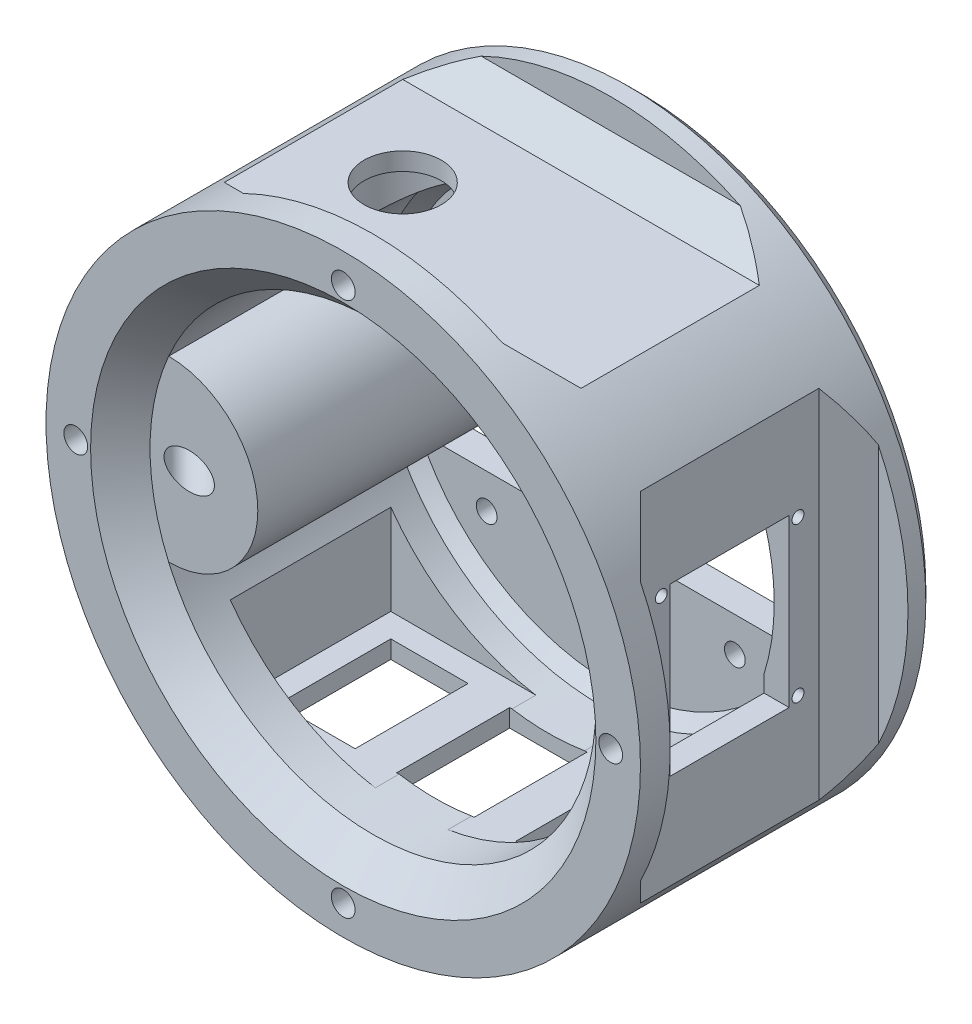
from build123d import *

# Parameters (mm, degrees)
ESQUISSE1_R                   = 50
BOSS_EXTRU_1_DEPTH            = 50
ENL_V_MAT_EXTRU_1_DEPTH       = 9.999999999999984
R_P_TITION_CIRCULAIRE1_COUNT  = 4
CHANFREIN1_SIZE               = 5
ESQUISSE11_R                  = 13.500000000000002
BOSS_EXTRU_3_DEPTH            = 4.999999999999999
ESQUISSE4_R                   = 37.50000000000001
ENL_V_MAT_EXTRU_2_DEPTH       = 50
CHANFREIN2_SIZE               = 5
BOSS_EXTRU_2_DEPTH            = 4.9999999999999964
ESQUISSE5_R                   = 1.7500000000000004
ENL_V_MAT_EXTRU_3_DEPTH       = 5
ESQUISSE7_R                   = 2.000000000000003
ENL_V_MAT_EXTRU_4_DEPTH       = 5.999999999999993
R_P_TITION_CIRCULAIRE2_COUNT  = 4
CHANFREIN3_SIZE               = 2
ESQUISSE8_W                   = 13
ESQUISSE8_H                   = 19.000000000000004
ESQUISSE8_W_2                 = 12.999999999999996
ESQUISSE8_H_2                 = 18.999999999999993
ENL_V_MAT_EXTRU_5_DEPTH       = 18.999999999999986
ENL_V_MAT_EXTRU_6_REACH       = 106.174
ENL_V_MAT_EXTRU_8_DEPTH       = 19.000000000000004
BOSS_EXTRU_4_DEPTH            = 45.000000000000014
ENL_V_START                   = 17
ESQUISSE12_R                  = 13.500000000000002
ENL_V_MAT_EXTRU_10_DEPTH      = 17
ESQUISSE15_R                  = 3.0000000000000013
ENL_V_MAT_EXTRU_11_DEPTH      = 17
ESQUISSE16_R                  = 11.99999999999999
ENL_V_MAT_EXTRU_12_DEPTH      = 0.9999999999999931
CHANFREIN4_SIZE               = 7
CHANFREIN5_SIZE               = 2
ENL_V_MAT_EXTRU_13_DEPTH      = 5.999999999999993
ENL_V_MAT_EXTRU_14_DEPTH      = 0.9999999999999931
ENL_V_MAT_EXTRU_14_DEPTH_BACK = 5.999999999999993
ESQUISSE19_R                  = 0.9999999999999983
ENL_V_MAT_EXTRU_15_DEPTH      = 5.999999999999993
ESQUISSE20_R                  = 6.499999999999999
ENL_V_MAT_EXTRU_16_DEPTH      = 13
ENL_V_MAT_EXTRU_17_DEPTH      = 7.9999999999999964
ENL_V_MAT_EXTRU_17_DEPTH_BACK = 7.9999999999999964
ESQUISSE21_R                  = 11.500000000000004


with BuildPart() as part:
    # Esquisse1 → Boss.-Extru.1 (new body)
    with BuildSketch(Plane.XY):
        Circle(ESQUISSE1_R)
    extrude(amount=BOSS_EXTRU_1_DEPTH)

    # Esquisse3 → Enlèv. mat.-Extru.1 (cut)
    with BuildSketch(Plane(origin=(0, 50, 0), x_dir=(1, 0, 0), z_dir=(0, 1, 0))):
        Polygon((0, -45), (0, -4.9999999999999964), (-45.00000000000001, -5.000000000000003), (-45.00000000000001, -45.00000000000001), align=None)
        Polygon((44.99999999999999, -4.99999999999999), (0, -4.9999999999999964), (0, -45), (45, -44.99999999999999), align=None)
    enl_v_mat_extru_1 = extrude(amount=-ENL_V_MAT_EXTRU_1_DEPTH, mode=Mode.SUBTRACT)

    # Répétition circulaire1: Enlèv. mat.-Extru.1 ×4 about axis
    r_p_tition_circulaire1_axis = Axis((0, 0, 0), (0, 0, 1))
    for i in range(1, R_P_TITION_CIRCULAIRE1_COUNT):
        add(enl_v_mat_extru_1.rotate(r_p_tition_circulaire1_axis, i * 360 / R_P_TITION_CIRCULAIRE1_COUNT), mode=Mode.SUBTRACT)

    # Chanfrein1
    chanfrein1_edges = [part.edges().sort_by_distance(p)[0] for p in [
        (0, 40.000000000000014, 45),
        (40.000000000000014, -8.88e-15, 45),
        (40.000000000000014, -8.88e-15, 4.9999999999999964),
        (-4.9e-15, -40.000000000000014, 4.9999999999999964),
        (-40.000000000000014, 4.44e-15, 4.9999999999999964),
        (-4.9e-15, -40.000000000000014, 45),
        (-40.000000000000014, 4.44e-15, 45),
        (0, 40.000000000000014, 4.9999999999999964),
    ]]
    chamfer(chanfrein1_edges, length=CHANFREIN1_SIZE)

    # Esquisse11 → Boss.-Extru.3 (add)
    with BuildSketch(Plane(origin=(-2.499999999999722, 2.657e-14, -2.49999999999975), x_dir=(-0.7071067811865515, -7.515584591766378e-15, 0.7071067811865436), z_dir=(-0.7071067811865436, 7.515584591766462e-15, -0.7071067811865515))):
        with Locations((53.67514421272203, -2.4659e-13)):
            Circle(ESQUISSE11_R)
    extrude(amount=-BOSS_EXTRU_3_DEPTH)

    # Esquisse4 → Enlèv. mat.-Extru.2 (cut)
    with BuildSketch(Plane(origin=(0, 0, 0), x_dir=(-1, 0, 0), z_dir=(0, 0, -1))):
        Circle(ESQUISSE4_R)
    extrude(amount=-ENL_V_MAT_EXTRU_2_DEPTH, mode=Mode.SUBTRACT)

    # Chanfrein2
    chanfrein2_edges = [part.edges().sort_by_distance(p)[0] for p in [
        (37.50000000000001, 4.59e-15, 50),
    ]]
    chamfer(chanfrein2_edges, length=CHANFREIN2_SIZE)

    # Esquisse6 → Boss.-Extru.2 (add)
    with BuildSketch(Plane(origin=(0, 0, 0), x_dir=(-1, 0, 0), z_dir=(0, 0, -1))):
        with BuildLine():
            ThreePointArc((34.369317712168815, 15.000000000000002), (2.3e-15, 37.500000000000014), (-34.369317712168815, 15.000000000000004))
            Line((-34.36931771216881, 15), (34.36931771216881, 15))
        make_face()
        with BuildLine():
            Line((34.36931771216881, -15), (-34.36931771216881, -15))
            ThreePointArc((-34.369317712168815, -14.999999999999996), (-6.89e-15, -37.500000000000014), (34.369317712168815, -15.000000000000009))
        make_face()
    extrude(amount=-BOSS_EXTRU_2_DEPTH)

    # Esquisse5 → Enlèv. mat.-Extru.3 (cut)
    with BuildSketch(Plane(origin=(0, 0, 0), x_dir=(-1, 0, 0), z_dir=(0, 0, -1))):
        with Locations((-20.875, 20.844288786139956)):
            Circle(ESQUISSE5_R)
        with Locations((20.875, 20.844288786139956)):
            Circle(ESQUISSE5_R)
        with Locations((-20.875, -20.844288786139956)):
            Circle(ESQUISSE5_R)
        with Locations((20.875, -20.844288786139956)):
            Circle(ESQUISSE5_R)
    extrude(amount=-ENL_V_MAT_EXTRU_3_DEPTH, mode=Mode.SUBTRACT)

    # Esquisse7 → Enlèv. mat.-Extru.4 (cut)
    with BuildSketch(Plane.XY.offset(50)):
        with Locations((-45, 0)):
            Circle(ESQUISSE7_R)
    enl_v_mat_extru_4 = extrude(amount=-ENL_V_MAT_EXTRU_4_DEPTH, mode=Mode.SUBTRACT)

    # Répétition circulaire2: Enlèv. mat.-Extru.4 ×4 about axis
    r_p_tition_circulaire2_axis = Axis((0, 7.856e-14, 0), (0, 0, 1))
    for i in range(1, R_P_TITION_CIRCULAIRE2_COUNT):
        add(enl_v_mat_extru_4.rotate(r_p_tition_circulaire2_axis, i * 360 / R_P_TITION_CIRCULAIRE2_COUNT), mode=Mode.SUBTRACT)

    # Chanfrein3
    chanfrein3_edges = [part.edges().sort_by_distance(p)[0] for p in [
        (0, 37.50000000000002, 4.9999999999999964),
        (5.33e-15, -37.50000000000001, 4.9999999999999964),
    ]]
    chamfer(chanfrein3_edges, length=CHANFREIN3_SIZE)

    # Esquisse8 → Enlèv. mat.-Extru.5 (cut)
    with BuildSketch(Plane.XZ.offset(40.00000000000002)):
        with Locations((-19.999999999999975, 25.000000000000014)):
            Rectangle(ESQUISSE8_W, ESQUISSE8_H)
        Polygon((6.500000000000003, 15.500000000000291), (6.500000000000003, 34.500000000000284), (-6.499999999999999, 34.500000000000284), (-6.499999999999996, 15.500000000000291), align=None)
        with Locations((19.99999999999998, 25.00000000000001)):
            Rectangle(ESQUISSE8_W_2, ESQUISSE8_H_2)
    extrude(amount=-ENL_V_MAT_EXTRU_5_DEPTH, mode=Mode.SUBTRACT)

    # Enlèv. mat.-Extru.6: up to this face of the body (flat: up to its plane)
    enl_v_mat_extru_6_end = Plane(part.part.faces().sort_by_distance((-26.5, -33.266499161, 25))[0])
    # Esquisse9 → Enlèv. mat.-Extru.6 (cut, up to the picked face)
    with BuildSketch(Plane.ZY.offset(-26.49999999999998), mode=Mode.PRIVATE) as enl_v_mat_extru_6_sk1:
        Polygon((15.500000000000014, -26.53299832284323), (15.500000000000014, -37.00000000000002), (34.50000000000001, -37.00000000000002), (34.50000000000001, -26.532998322843227), align=None)
    enl_v_mat_extru_6_tool1 = split(extrude(enl_v_mat_extru_6_sk1.sketch, amount=ENL_V_MAT_EXTRU_6_REACH, mode=Mode.PRIVATE), bisect_by=enl_v_mat_extru_6_end, keep=Keep.BOTH, mode=Mode.PRIVATE)
    add(enl_v_mat_extru_6_tool1.solids().sort_by(Axis((26.5, -31.766499, 25), (-1, 0, 0)))[0], mode=Mode.SUBTRACT)

    # Esquisse10 → Enlèv. mat.-Extru.8 (cut)
    with BuildSketch(Plane(origin=(0, -37.00000000000002, 0), x_dir=(1, 0, 0), z_dir=(0, 1, 0))):
        Polygon((30.49999999999998, -38.50000000000001), (30.49999999999997, -11.500000000000014), (-30.499999999999968, -11.500000000000014), (-30.499999999999968, -38.500000000000014), align=None)
    extrude(amount=ENL_V_MAT_EXTRU_8_DEPTH, mode=Mode.SUBTRACT)

    # Esquisse14 → Boss.-Extru.4 (add)
    with BuildSketch(Plane(origin=(0, 0, 0), x_dir=(-1, 0, 0), z_dir=(0, 0, -1))):
        with BuildLine():
            ThreePointArc((34.36931771216881, 15), (19.369317712168808, 1.84e-15), (34.36931771216881, -15))
            ThreePointArc((34.36931771216881, -15), (37.50000000000001, 0), (34.36931771216881, 15))
        make_face()
    extrude(amount=-BOSS_EXTRU_4_DEPTH)

    # Esquisse12 → Enlèv. mat.-Extru.10 (cut)
    with BuildSketch(Plane(origin=(-2.4999999999997247, 2.657e-14, -2.499999999999752), x_dir=(-0.7071067811865515, -7.515584591766378e-15, 0.7071067811865436), z_dir=(-0.7071067811865436, 7.515584591766462e-15, -0.7071067811865515)).offset(ENL_V_START)):
        with Locations((53.67514421272203, -2.4659e-13)):
            Circle(ESQUISSE12_R)
    extrude(amount=-ENL_V_MAT_EXTRU_10_DEPTH, mode=Mode.SUBTRACT)

    # Esquisse15 → Enlèv. mat.-Extru.11 (cut)
    with BuildSketch(Plane(origin=(-2.4999999999997247, 2.657e-14, -2.499999999999752), x_dir=(-0.7071067811865515, -7.515584591766378e-15, 0.7071067811865436), z_dir=(-0.7071067811865436, 7.515584591766462e-15, -0.7071067811865515))):
        with Locations((53.67514421272203, -2.4659e-13)):
            Circle(ESQUISSE15_R)
    extrude(amount=-ENL_V_MAT_EXTRU_11_DEPTH, mode=Mode.SUBTRACT)

    # Esquisse16 → Enlèv. mat.-Extru.12 (cut)
    with BuildSketch(Plane(origin=(-2.4999999999997247, 2.657e-14, -2.499999999999752), x_dir=(-0.7071067811865515, -7.515584591766378e-15, 0.7071067811865436), z_dir=(-0.7071067811865436, 7.515584591766462e-15, -0.7071067811865515))):
        with Locations((53.67514421272203, -2.4659e-13)):
            Circle(ESQUISSE16_R)
    extrude(amount=-ENL_V_MAT_EXTRU_12_DEPTH, mode=Mode.SUBTRACT)

    # Chanfrein4
    chanfrein4_edges = [part.edges().sort_by_distance(p)[0] for p in [
        (37.50000000000001, 4.59e-15, 0),
    ]]
    chamfer(chanfrein4_edges, length=CHANFREIN4_SIZE)

    # Chanfrein5
    chanfrein5_edges = [part.edges().sort_by_distance(p)[0] for p in [
        (-50, 6.12e-15, 0),
    ]]
    chamfer(chanfrein5_edges, length=CHANFREIN5_SIZE)

    # Esquisse17 → Enlèv. mat.-Extru.13 (cut)
    with BuildSketch(Plane(origin=(40.00000000000002, -1.3966e-13, 0), x_dir=(0, 0, -1), z_dir=(1, -3.49e-15, 0))):
        Polygon((-15.000000000000014, -13.999999999999998), (-35.000000000000014, -14), (-35.000000000000014, 13.999999999999998), (-15.000000000000014, 14.000000000000002), align=None)
    extrude(amount=-ENL_V_MAT_EXTRU_13_DEPTH, mode=Mode.SUBTRACT)

    # Esquisse18 → Enlèv. mat.-Extru.14 (cut, two sides: drawn at the far end of the back side and taken through both)
    with BuildSketch(Plane(origin=(34.7886475735979, -1.4656e-13, -2.414e-14), x_dir=(-6.9e-16, 0, -1), z_dir=(1, -4.21e-15, -6.9e-16)).offset(-ENL_V_MAT_EXTRU_14_DEPTH_BACK)):
        Polygon((-10.00000000000004, -18.999999999999968), (-10.00000000000004, 19.000000000000032), (-40.00000000000004, 19.00000000000003), (-40.00000000000004, -18.99999999999997), align=None)
    extrude(amount=ENL_V_MAT_EXTRU_14_DEPTH + ENL_V_MAT_EXTRU_14_DEPTH_BACK, mode=Mode.SUBTRACT)

    # Esquisse19 → Enlèv. mat.-Extru.15 (cut)
    with BuildSketch(Plane(origin=(40.00000000000002, -1.3966e-13, 0), x_dir=(0, 0, -1), z_dir=(1, -3.49e-15, 0))):
        with Locations(Location((-36.500000000000014, -13.000000000000002, 0), (0, 0, 90))):
            Circle(ESQUISSE19_R)
        with Locations(Location((-13.500000000000005, -13.000000000000002, 0), (0, 0, 90))):
            Circle(ESQUISSE19_R)
    enl_v_mat_extru_15 = extrude(amount=-ENL_V_MAT_EXTRU_15_DEPTH, mode=Mode.SUBTRACT)

    # Symétrie1: Enlèv. mat.-Extru.15 across plane
    add(enl_v_mat_extru_15.mirror(Plane.ZX), mode=Mode.SUBTRACT)

    # Esquisse20 → Enlèv. mat.-Extru.16 (cut)
    with BuildSketch(Plane(origin=(0, 40.00000000000002, 0), x_dir=(1, 0, 0), z_dir=(0, 1, 0))):
        with Locations(Location((-14.999999999999986, -25.00000000000001, 0), (0, 0, 270))):
            Circle(ESQUISSE20_R)
    extrude(amount=-ENL_V_MAT_EXTRU_16_DEPTH, mode=Mode.SUBTRACT)

    # Esquisse21 → Enlèv. mat.-Extru.17 (cut, two sides: drawn at the far end of the back side and taken through both)
    with BuildSketch(Plane(origin=(0, 29.00000000000002, 0), x_dir=(1, 0, 0), z_dir=(0, 1, 0)).offset(-ENL_V_MAT_EXTRU_17_DEPTH_BACK)):
        with Locations((-14.999999999999986, -25.00000000000001)):
            Circle(ESQUISSE21_R)
    extrude(amount=ENL_V_MAT_EXTRU_17_DEPTH + ENL_V_MAT_EXTRU_17_DEPTH_BACK, mode=Mode.SUBTRACT)


solid = part.part
